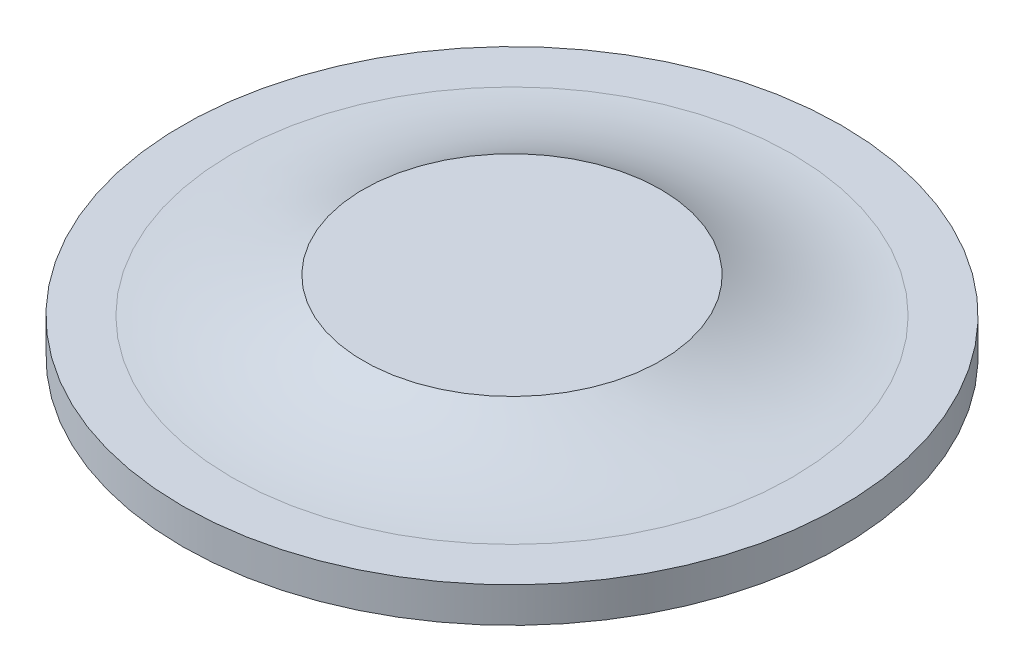
from build123d import *


with BuildPart() as part:
    # Sketch1 → Revolve1 (revolve)
    with BuildSketch(Plane(origin=(0, 0, 0), x_dir=(0, 0, -1), z_dir=(1, 0, 0))):
        with BuildLine():
            ThreePointArc((33.829271399, 16), (48.264119334, 10.034520931), (63.75, 8))
            Line((63.75, 8), (75, 8))
            Line((75, 8), (75, 0))
            Line((75, 0), (0, 0))
            Line((0, 0), (0, 16))
            Line((0, 16), (33.829271399, 16))
        make_face()
    revolve(axis=Axis((0, 0, 0), (0, 1, 0)))


solid = part.part
